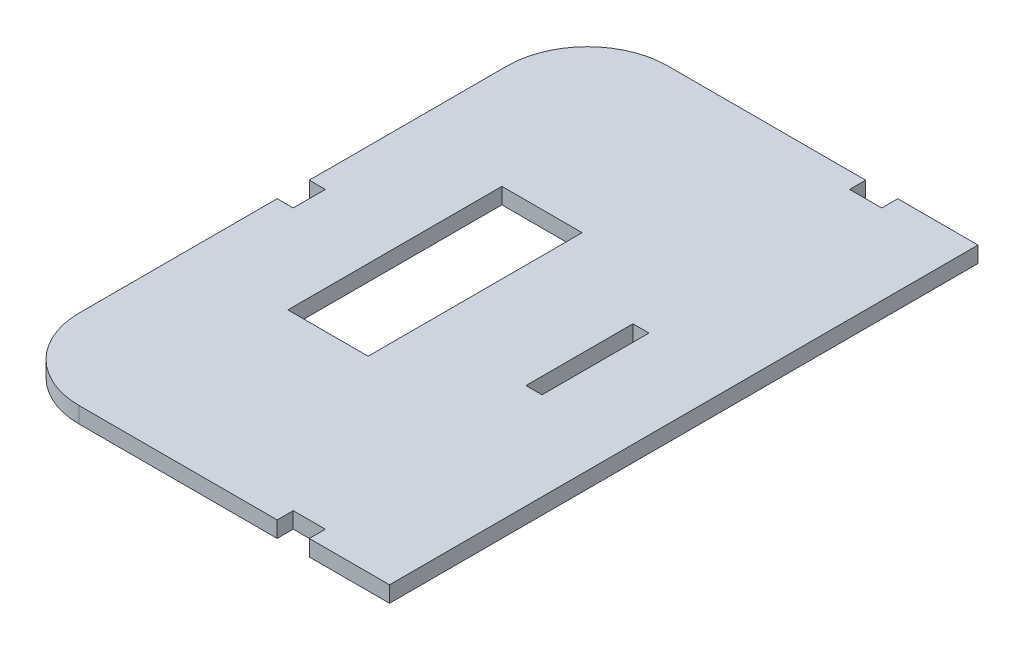
from build123d import *

# Parameters (mm, degrees)
EXTRUDE_3_DEPTH    = 3
SKETCH1_W          = 15
SKETCH1_H          = 40
SKETCH1_W_2        = 3
SKETCH1_H_2        = 20
CUT_EXTRUDE1_DEPTH = 10
FILLET1_R          = 15


with BuildPart() as part:
    # Эскиз4 → Бобышка-Вытянуть3 (new body)
    with BuildSketch(Plane(origin=(0, 0, 0), x_dir=(1, 0, 0), z_dir=(0, 1, 0))):
        Polygon((0, 110), (0, 58), (3, 58), (3, 52), (0, 52), (0, 0), (52, 0), (52, 3), (58, 3), (58, 0), (73, 0), (73, 110), (58, 110), (58, 107), (52, 107), (52, 110), align=None)
    extrude(amount=EXTRUDE_3_DEPTH)

    # Sketch1 → Cut-Extrude1 (cut)
    with BuildSketch(Plane(origin=(0, 3, 0), x_dir=(1, 0, 0), z_dir=(0, 1, 0))):
        with Locations((26.5, 55)):
            Rectangle(SKETCH1_W, SKETCH1_H)
        with Locations((55, 55)):
            Rectangle(SKETCH1_W_2, SKETCH1_H_2)
    extrude(amount=-CUT_EXTRUDE1_DEPTH, mode=Mode.SUBTRACT)

    # Fillet1
    fillet1_edges = [part.edges().sort_by_distance(p)[0] for p in [
        (0, 1.5, 0),
        (0, 1.5, -110),
    ]]
    fillet(fillet1_edges, radius=FILLET1_R)


solid = part.part
